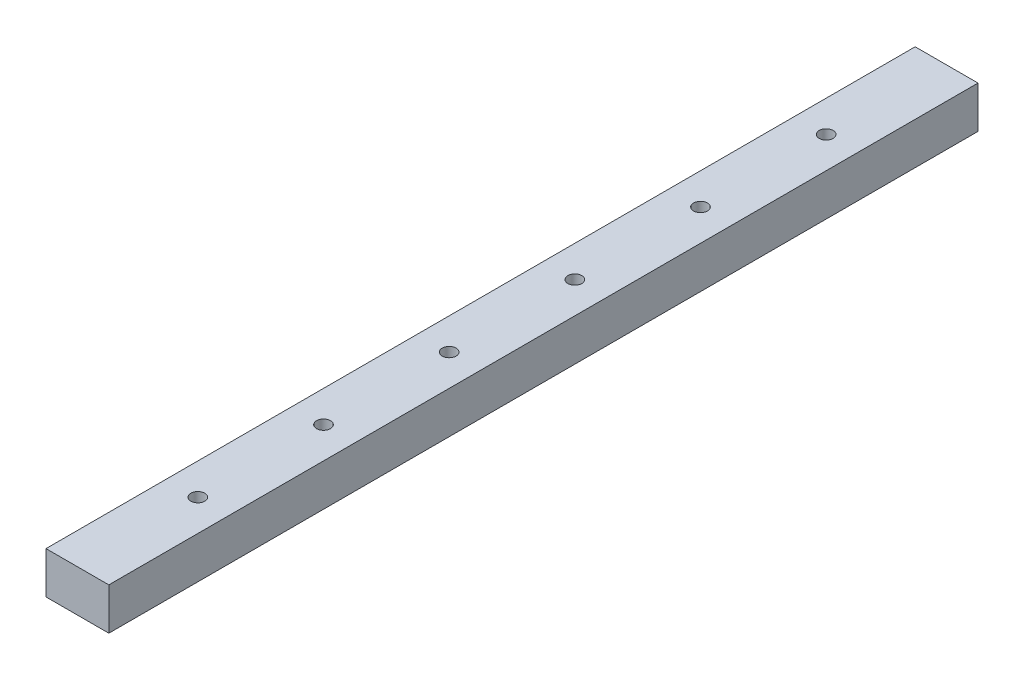
from build123d import *

# Parameters (mm, degrees)
SKETCH1_W                                         = 38.1
SKETCH1_H                                         = 25.4
BOSS_EXTRUDE1_DEPTH                               = 527.05
CSK_FOR_5_16_FLAT_HEAD_MACHINE_SCREW1_D           = 8.4328
CSK_FOR_5_16_FLAT_HEAD_MACHINE_SCREW1_CSINK_D     = 16.129
CSK_FOR_5_16_FLAT_HEAD_MACHINE_SCREW1_CSINK_ANGLE = 82


with BuildPart() as part:
    # Sketch1 → Boss-Extrude1 (new body)
    with BuildSketch(Plane.XY):
        with Locations((-3.175, 0)):
            Rectangle(SKETCH1_W, SKETCH1_H)
    extrude(amount=BOSS_EXTRUDE1_DEPTH)

    # CSK for 5/16 Flat Head Machine Screw1 (through all)
    with Locations(Plane(origin=(0, -12.7, 0), x_dir=(-1, 0, 0), z_dir=(0, -1, 0))):
        with Locations((3.175, -454.025), (3.175, -377.825), (3.175, -301.625), (3.175, -225.425), (3.175, -149.225), (3.175, -73.025)):
            CounterSinkHole(CSK_FOR_5_16_FLAT_HEAD_MACHINE_SCREW1_D / 2, CSK_FOR_5_16_FLAT_HEAD_MACHINE_SCREW1_CSINK_D / 2, counter_sink_angle=CSK_FOR_5_16_FLAT_HEAD_MACHINE_SCREW1_CSINK_ANGLE)


solid = part.part
